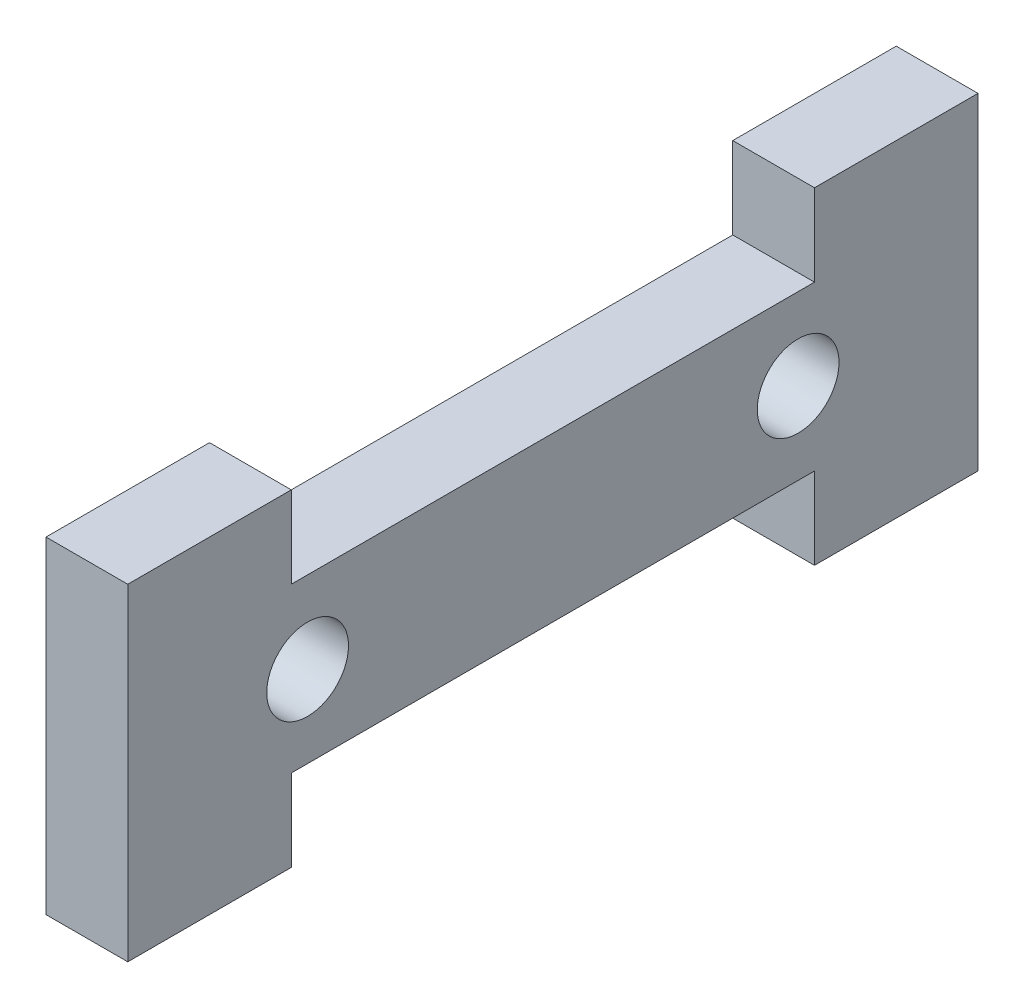
from build123d import *

# Parameters (mm, degrees)
SKETCH1_R           = 3.175
BOSS_EXTRUDE1_DEPTH = 6.35


with BuildPart() as part:
    # Sketch1 → Boss-Extrude1 (new body)
    with BuildSketch(Plane(origin=(0, 0, 0), x_dir=(0, 0, -1), z_dir=(1, 0, 0))):
        Polygon((-20.32, 12.7), (-20.32, 6.35), (20.32, 6.35), (20.32, 12.7), (33.02, 12.7), (33.02, -12.7), (20.32, -12.7), (20.32, -6.35), (-20.32, -6.35), (-20.32, -12.7), (-33.02, -12.7), (-33.02, 12.7), align=None)
        with Locations((-19.05, 0)):
            Circle(SKETCH1_R, mode=Mode.SUBTRACT)
        with Locations((19.05, 0)):
            Circle(SKETCH1_R, mode=Mode.SUBTRACT)
    extrude(amount=BOSS_EXTRUDE1_DEPTH)


solid = part.part
